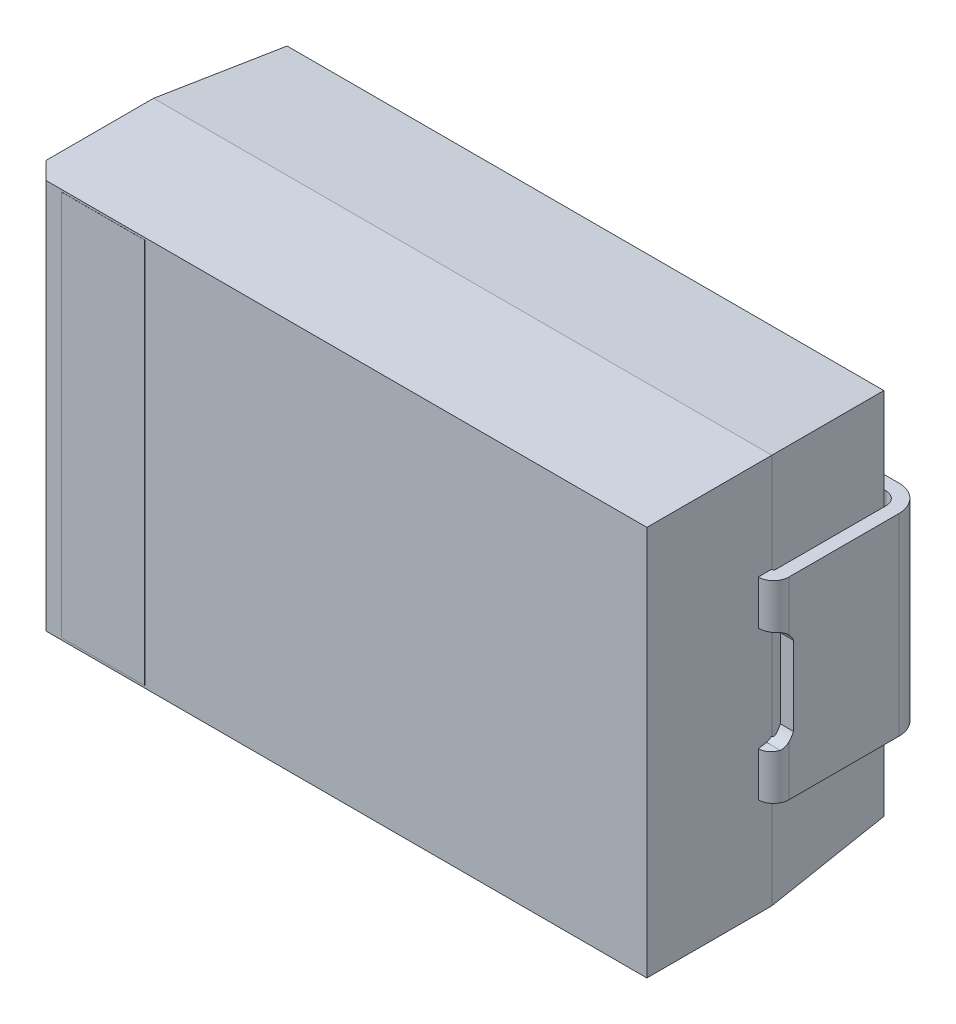
from build123d import *

# Parameters (mm, degrees)
EXTRUDE_START        = 0.2
SKETCH_1_W           = 4.5
SKETCH_1_H           = 4
EXTRUDE_1_DEPTH      = 0.2
EXTRUDE_START_2      = 1.575
SKETCH_2_W           = 7.05
SKETCH_2_H           = 4.45
EXTRUDE_2_DEPTH      = 1.425
SKETCH_2_2_W         = 7.05
SKETCH_2_2_H         = 4.45
EXTRUDE_3_DEPTH      = 1.4
EXTRUDE_3_DRAFT      = -5
EXTRUDE_4_DEPTH      = 1.1
EXTRUDE_4_DEPTH_BACK = 1.1
CUT_EXTRUDE_START    = -3.525
CUT_EXTRUDE_1_DEPTH  = 0.3
CUT_EXTRUDE_START_2  = 3.525
CUT_EXTRUDE_2_DEPTH  = 0.5
CHAMFER_1_SIZE       = 0.2
CHAMFER_2_SIZE       = 0.1
EXTRUDE_START_3      = 3
SKETCH_7_W           = 0.95
SKETCH_7_H           = 4.4
EXTRUDE_5_DEPTH      = 0.001


with BuildPart() as part:
    # Эскиз1 → Бобышка-Вытянуть1 (new body)
    with BuildSketch(Plane.XY.offset(EXTRUDE_START)):
        Rectangle(SKETCH_1_W, SKETCH_1_H)
    extrude(amount=-EXTRUDE_1_DEPTH)


with BuildPart() as body_2:
    # Эскиз2 → Бобышка-Вытянуть2 (new body)
    with BuildSketch(Plane.XY.offset(EXTRUDE_START_2)):
        Rectangle(SKETCH_2_W, SKETCH_2_H)
    extrude(amount=EXTRUDE_2_DEPTH)



with BuildPart() as extrude_3_tool:
    # Эскиз2<2> → Бобышка-Вытянуть3 (with draft: the straight prism first)
    with BuildSketch(Plane.XY.offset(EXTRUDE_START_2)):
        Rectangle(SKETCH_2_2_W, SKETCH_2_2_H)
    extrude(amount=-EXTRUDE_3_DEPTH)
    # Бобышка-Вытянуть3: the draft: its side faces are tilted about the plane it starts from
    extrude_3_sides = [extrude_3_tool.faces().sort_by_distance(p)[0] for p in [
        (0, 2.225, 0.875),
        (-3.525, 0, 0.875),
        (0, -2.225, 0.875),
        (3.525, 0, 0.875),
    ]]
    draft(extrude_3_sides, Plane.XY.offset(EXTRUDE_START_2), EXTRUDE_3_DRAFT)


with BuildPart() as part_1:
    add(part.part)

    # Бобышка-Вытянуть3: add extrude_3_tool
    add(extrude_3_tool.part)


with BuildPart() as body_2_1:
    add(body_2.part)

    add(part_1.part)  # Бобышка-Вытянуть4 merges part
    # Эскиз3 → Бобышка-Вытянуть4 (add, two sides: drawn at the far end of the back side and taken through both)
    with BuildSketch(Plane(origin=(0, 0, 0), x_dir=(1, 0, 0), z_dir=(0, 1, 0)).offset(-EXTRUDE_4_DEPTH_BACK)):
        with BuildLine():
            Line((-2.429, -0.150000003), (-2.429, 0))
            Line((-2.429, 0), (-3.4, 0))
            ThreePointArc((-3.4, 0), (-3.612132034, -0.087867966), (-3.7, -0.3))
            Line((-3.7, -0.3), (-3.7, -1.555))
            ThreePointArc((-3.7, -1.555), (-3.648743687, -1.678743687), (-3.525, -1.73))
            Line((-3.525, -1.73), (-3.525, -1.579999997))
            ThreePointArc((-3.525, -1.579999997), (-3.542677667, -1.572677667), (-3.549999997, -1.555))
            Line((-3.549999997, -1.555), (-3.549999997, -0.3))
            ThreePointArc((-3.549999997, -0.3), (-3.506066015, -0.193933985), (-3.4, -0.150000003))
            Line((-3.4, -0.150000003), (-2.429, -0.150000003))
        make_face()
        with BuildLine():
            Line((3.525, -1.73), (3.525, -1.579999997))
            ThreePointArc((3.525, -1.579999997), (3.542677667, -1.572677667), (3.549999997, -1.555))
            Line((3.549999997, -1.555), (3.549999997, -0.3))
            ThreePointArc((3.549999997, -0.3), (3.506066015, -0.193933985), (3.4, -0.150000003))
            Line((3.4, -0.150000003), (2.429, -0.150000003))
            Line((2.429, -0.150000003), (2.429, 0))
            Line((2.429, 0), (3.4, 0))
            ThreePointArc((3.4, 0), (3.612132034, -0.087867966), (3.7, -0.3))
            Line((3.7, -0.3), (3.7, -1.555))
            ThreePointArc((3.7, -1.555), (3.648743687, -1.678743687), (3.525, -1.73))
        make_face()
    extrude(amount=EXTRUDE_4_DEPTH + EXTRUDE_4_DEPTH_BACK)

    # Эскиз6 → Вырез-Вытянуть1 (cut)
    with BuildSketch(Plane(origin=(0, 0, 0), x_dir=(0, 0, -1), z_dir=(1, 0, 0)).offset(CUT_EXTRUDE_START)):
        with BuildLine():
            Line((-0.765667903, 0.449999989), (-0.765667903, -0.450000011))
            ThreePointArc((-0.765667903, -0.450000011), (-0.802046232, -0.5480485), (-0.893714872, -0.598384864))
            Line((-0.893714872, -0.598384864), (-1.75337045, -0.724339871))
            Line((-1.75337045, -0.724339871), (-1.75337045, 0.724408738))
            Line((-1.75337045, 0.724408738), (-0.893668232, 0.598168725))
            ThreePointArc((-0.893668232, 0.598168725), (-0.8020993, 0.547900523), (-0.765667903, 0.449999989))
        make_face()
    extrude(amount=-CUT_EXTRUDE_1_DEPTH, mode=Mode.SUBTRACT)

    # Эскиз5 → Вырез-Вытянуть2 (cut)
    with BuildSketch(Plane(origin=(0, 0, 0), x_dir=(0, 0, -1), z_dir=(1, 0, 0)).offset(CUT_EXTRUDE_START_2)):
        with BuildLine():
            Line((-1.503947649, 0.45), (-1.503947649, -0.45))
            ThreePointArc((-1.503947649, -0.45), (-1.555789292, -0.528967365), (-1.634421568, -0.581315866))
            Line((-1.634421568, -0.581315866), (-1.833406663, -0.610535147))
            Line((-1.833406663, -0.610535147), (-1.833406663, 0.610535147))
            Line((-1.833406663, 0.610535147), (-1.634421568, 0.581315866))
            ThreePointArc((-1.634421568, 0.581315866), (-1.555789292, 0.528967365), (-1.503947649, 0.45))
        make_face()
    extrude(amount=CUT_EXTRUDE_2_DEPTH, mode=Mode.SUBTRACT)

    # Фаска1
    chamfer_1_edges = [body_2_1.edges().sort_by_distance(p)[0] for p in [
        (-3.525, 0, 3),
    ]]
    chamfer(chamfer_1_edges, length=CHAMFER_1_SIZE)

    # Фаска2
    chamfer_2_edges = [body_2_1.edges().sort_by_distance(p)[0] for p in [
        (-2.25, 0, 0),
        (0, 2, 0),
        (2.25, 0, 0),
        (0, -2, 0),
    ]]
    chamfer(chamfer_2_edges, length=CHAMFER_2_SIZE)


with BuildPart() as body_2_2:
    # Эскиз7 → Бобышка-Вытянуть5 (new body)
    with BuildSketch(Plane.XY.offset(EXTRUDE_START_3)):
        with Locations((-2.675, 0)):
            Rectangle(SKETCH_7_W, SKETCH_7_H)
    extrude(amount=EXTRUDE_5_DEPTH)


solid = Compound([body_2_1.part, body_2_2.part])
